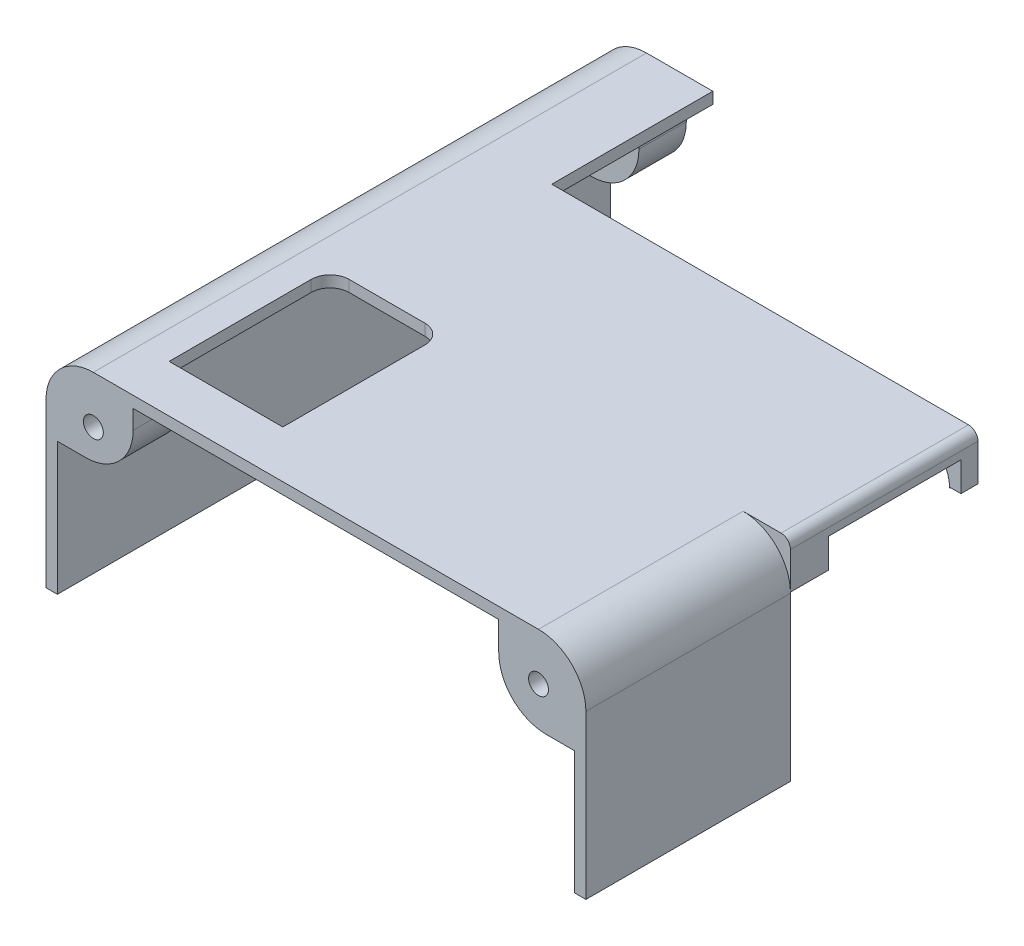
from build123d import *

# Parameters (mm, degrees)
SKETCH1_W           = 57
SKETCH1_H           = 22.6
BOSS_EXTRUDE1_DEPTH = 58.4
FILLET1_R           = 5
CUT_EXTRUDE1_DEPTH  = 58.4
SKETCH3_W           = 36.8
SKETCH3_H           = 17.7
CUT_EXTRUDE2_DEPTH  = 1.2
SKETCH5_W           = 45
SKETCH5_H           = 17
CUT_EXTRUDE5_DEPTH  = 69.895242719
SKETCH6_W           = 12
SKETCH6_H           = 17
CUT_EXTRUDE6_DEPTH  = 1.2
FILLET3_R           = 2
SKETCH7_R           = 1.05
BOSS_EXTRUDE2_DEPTH = 5
FILLET4_R           = 5
BOSS_EXTRUDE3_START = -5
SKETCH8_R           = 1.05
BOSS_EXTRUDE3_DEPTH = 5
FILLET5_R           = 5
SKETCH10_W          = 9.1
SKETCH10_H          = 6
BOSS_EXTRUDE4_DEPTH = 6
CUT_EXTRUDE8_REACH  = 89.705
SKETCH11_W          = 5
SKETCH11_H          = 5
FILLET6_R           = 3
FILLET7_R           = 3
FILLET8_R           = 1
SKETCH12_W          = 57
SKETCH12_H          = 0.4
CUT_EXTRUDE9_DEPTH  = 71.208070265
BOSS_EXTRUDE5_DEPTH = 19.8
SKETCH4_W           = 14
SKETCH4_H           = 3.2
CUT_EXTRUDE3_DEPTH  = 5
FILLET9_R           = 1


with BuildPart() as part:
    # Sketch1 → Boss-Extrude1 (new body)
    with BuildSketch(Plane.XY):
        with Locations((-0.22689453, 6.382078673)):
            Rectangle(SKETCH1_W, SKETCH1_H)
    extrude(amount=BOSS_EXTRUDE1_DEPTH)

    # Fillet1
    fillet1_edges = [part.edges().sort_by_distance(p)[0] for p in [
        (-28.72689453, 17.682078673, 29.2),
        (28.27310547, 17.682078673, 29.2),
    ]]
    fillet(fillet1_edges, radius=FILLET1_R)

    # Sketch2 → Cut-Extrude1 (cut)
    with BuildSketch(Plane.XY.offset(58.4)):
        with BuildLine():
            Line((-27.52689453, -4.917921327), (27.07310547, -4.917921327))
            Line((27.07310547, -4.917921327), (27.07310547, 12.682078673))
            ThreePointArc((27.07310547, 12.682078673), (25.960111239, 15.369084441), (23.27310547, 16.482078673))
            Line((23.27310547, 16.482078673), (-23.72689453, 16.482078673))
            ThreePointArc((-23.72689453, 16.482078673), (-26.413900298, 15.369084441), (-27.52689453, 12.682078673))
            Line((-27.52689453, 12.682078673), (-27.52689453, -4.917921327))
        make_face()
    extrude(amount=-CUT_EXTRUDE1_DEPTH, mode=Mode.SUBTRACT)

    # Sketch3 → Cut-Extrude2 (cut)
    with BuildSketch(Plane(origin=(28.27310547, 0, 0), x_dir=(0, 0, -1), z_dir=(1, 0, 0))):
        with Locations((-18.4, 3.932078673)):
            Rectangle(SKETCH3_W, SKETCH3_H)
    extrude(amount=-CUT_EXTRUDE2_DEPTH, mode=Mode.SUBTRACT)

    # Sketch5 → Cut-Extrude5 (cut, through all)
    with BuildSketch(Plane(origin=(0, 17.682078673, 0), x_dir=(1, 0, 0), z_dir=(0, 1, 0))):
        with Locations((5.77210537, -8.5)):
            Rectangle(SKETCH5_W, SKETCH5_H)
    extrude(amount=-CUT_EXTRUDE5_DEPTH, mode=Mode.SUBTRACT)

    # Sketch6 → Cut-Extrude6 (cut)
    with BuildSketch(Plane(origin=(0, 17.682078673, 0), x_dir=(1, 0, 0), z_dir=(0, 1, 0))):
        with Locations((-14.72689453, -44.9)):
            Rectangle(SKETCH6_W, SKETCH6_H)
    extrude(amount=-CUT_EXTRUDE6_DEPTH, mode=Mode.SUBTRACT)

    # Fillet3
    fillet3_edges = [part.edges().sort_by_distance(p)[0] for p in [
        (-20.72689453, 17.082078673, 36.4),
        (-8.72689453, 17.082078673, 36.4),
    ]]
    fillet(fillet3_edges, radius=FILLET3_R)

    # Sketch7 → Boss-Extrude2 (add)
    # profile 1 of 2: a face of its own
    with BuildSketch(Plane.XY.offset(58.4)):
        with BuildLine():
            Line((-27.52689453, 9.482078673), (-19.52689453, 9.482078673))
            Line((-19.52689453, 9.482078673), (-19.52689453, 16.482078673))
            Line((-19.52689453, 16.482078673), (-23.72689453, 16.482078673))
            ThreePointArc((-23.72689453, 16.482078673), (-26.413900298, 15.369084441), (-27.52689453, 12.682078673))
            Line((-27.52689453, 12.682078673), (-27.52689453, 9.482078673))
        make_face()
        with Locations((-23.72689453, 12.682078673)):
            Circle(SKETCH7_R, mode=Mode.SUBTRACT)
    # profile 2 of 2: a face of its own
    with BuildSketch(Plane.XY.offset(58.4)):
        with BuildLine():
            Line((19.07310547, 16.482078673), (19.07310547, 8.482078673))
            Line((19.07310547, 8.482078673), (27.07310547, 8.482078673))
            Line((27.07310547, 8.482078673), (27.07310547, 12.682078673))
            ThreePointArc((27.07310547, 12.682078673), (25.960111239, 15.369084441), (23.27310547, 16.482078673))
            Line((23.27310547, 16.482078673), (19.07310547, 16.482078673))
        make_face()
        with Locations((23.27310547, 12.682078673)):
            Circle(SKETCH7_R, mode=Mode.SUBTRACT)
    extrude(amount=-BOSS_EXTRUDE2_DEPTH)

    # Fillet4
    fillet4_edges = [part.edges().sort_by_distance(p)[0] for p in [
        (-19.52689453, 9.482078673, 55.9),
        (19.07310547, 8.482078673, 55.9),
    ]]
    fillet(fillet4_edges, radius=FILLET4_R)

    # Sketch8 → Boss-Extrude3 (add)
    with BuildSketch(Plane(origin=(0, 0, 0), x_dir=(-1, 0, 0), z_dir=(0, 0, -1)).offset(BOSS_EXTRUDE3_START)):
        with BuildLine():
            Line((19.52689453, 16.482078673), (19.52689453, 8.482078673))
            Line((19.52689453, 8.482078673), (27.52689453, 8.482078673))
            Line((27.52689453, 8.482078673), (27.52689453, 12.682078673))
            ThreePointArc((27.52689453, 12.682078673), (26.413900298, 15.369084441), (23.72689453, 16.482078673))
            Line((23.72689453, 16.482078673), (19.52689453, 16.482078673))
        make_face()
        with Locations(Location((23.72689453, 12.682078673, 0), (0, 0, 180))):
            Circle(SKETCH8_R, mode=Mode.SUBTRACT)
    extrude(amount=BOSS_EXTRUDE3_DEPTH)

    # Fillet5
    fillet5_edges = [part.edges().sort_by_distance(p)[0] for p in [
        (-19.52689453, 8.482078673, 2.5),
    ]]
    fillet(fillet5_edges, radius=FILLET5_R)

    # Sketch10 → Boss-Extrude4 (add)
    with BuildSketch(Plane.ZY.offset(28.72689453)):
        with Locations((4.55, 0.282078673)):
            Rectangle(SKETCH10_W, SKETCH10_H)
    extrude(amount=BOSS_EXTRUDE4_DEPTH)

    # Cut-Extrude8: up to this face of the body (flat: up to its plane)
    cut_extrude8_end = Plane(part.part.faces().sort_by_distance((-27.52689453, 3.623812959, 29.334734165))[0])
    # Sketch11 → Cut-Extrude8 (cut, up to the picked face)
    with BuildSketch(Plane.ZY.offset(34.72689453), mode=Mode.PRIVATE) as cut_extrude8_sk1:
        with Locations((4.55, -2.417921327)):
            Rectangle(SKETCH11_W, SKETCH11_H)
    cut_extrude8_tool1 = split(extrude(cut_extrude8_sk1.sketch, amount=-CUT_EXTRUDE8_REACH, mode=Mode.PRIVATE), bisect_by=cut_extrude8_end, keep=Keep.BOTH, mode=Mode.PRIVATE)
    add(cut_extrude8_tool1.solids().sort_by(Axis((-34.726895, -2.417921, 4.55), (1, 0, 0)))[0], mode=Mode.SUBTRACT)

    # Fillet6
    fillet6_edges = [part.edges().sort_by_distance(p)[0] for p in [
        (-31.72689453, 3.282078673, 0),
        (-31.72689453, 3.282078673, 9.1),
    ]]
    fillet(fillet6_edges, radius=FILLET6_R)

    # Fillet7
    fillet7_edges = [part.edges().sort_by_distance(p)[0] for p in [
        (-34.72689453, -1.217921327, 9.1),
        (-34.72689453, 2.403399016, 8.221320344),
        (-34.72689453, -1.217921327, 0),
        (-34.72689453, 2.403399016, 0.878679656),
        (-34.72689453, 3.282078673, 4.55),
    ]]
    fillet(fillet7_edges, radius=FILLET7_R)

    # Fillet8
    fillet8_edges = [part.edges().sort_by_distance(p)[0] for p in [
        (-31.049699857, 0.082078673, 7.05),
        (-31.049699857, 0.082078673, 2.05),
    ]]
    fillet(fillet8_edges, radius=FILLET8_R)

    # Sketch12 → Cut-Extrude9 (cut, through all)
    with BuildSketch(Plane.XY.offset(58.4)):
        with Locations((-0.22689453, -4.717921327)):
            Rectangle(SKETCH12_W, SKETCH12_H)
    extrude(amount=-CUT_EXTRUDE9_DEPTH, mode=Mode.SUBTRACT)

    # Sketch15 → Boss-Extrude5 (add)
    with BuildSketch(Plane(origin=(0, 0, 17), x_dir=(-1, 0, 0), z_dir=(0, 0, -1))):
        with BuildLine():
            Line((-28.27210537, 12.782078673), (-27.27310547, 12.782078673))
            ThreePointArc((-27.27310547, 12.782078673), (-26.101532595, 15.610505797), (-23.27310547, 16.782078673))
            Line((-23.27310547, 16.782078673), (-23.27310547, 17.682078673))
            Line((-23.27310547, 17.682078673), (-28.27210537, 17.682078673))
            Line((-28.27210537, 17.682078673), (-28.27210537, 12.782078673))
        make_face()
    extrude(amount=-BOSS_EXTRUDE5_DEPTH)

    # Sketch4 → Cut-Extrude3 (cut)
    with BuildSketch(Plane(origin=(28.27310547, 0, 0), x_dir=(0, 0, -1), z_dir=(1, 0, 0))):
        with Locations((-25.8, 14.282078673)):
            Rectangle(SKETCH4_W, SKETCH4_H)
    extrude(amount=-CUT_EXTRUDE3_DEPTH, mode=Mode.SUBTRACT)

    # Fillet9
    fillet9_edges = [part.edges().sort_by_distance(p)[0] for p in [
        (28.27210537, 17.682078673, 26.9),
    ]]
    fillet(fillet9_edges, radius=FILLET9_R)


solid = part.part
